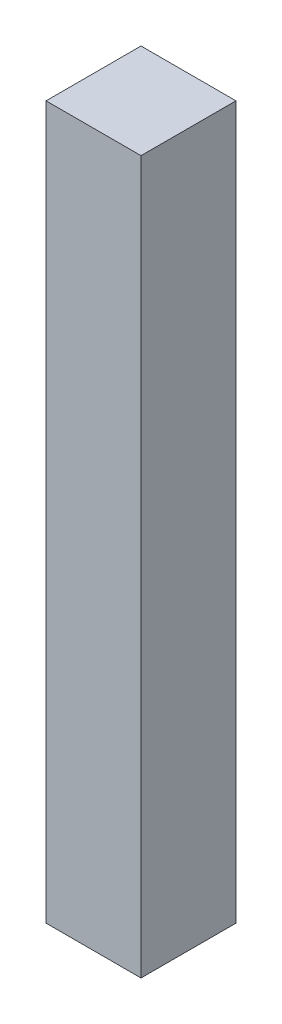
from build123d import *

# Parameters (mm, degrees)
SKETCH1_W           = 5.08
SKETCH1_H           = 38.1
BOSS_EXTRUDE1_DEPTH = 5.08


with BuildPart() as part:
    # Sketch1 → Boss-Extrude1 (new body)
    with BuildSketch(Plane.XY):
        with Locations((2.54, 19.05)):
            Rectangle(SKETCH1_W, SKETCH1_H)
    extrude(amount=BOSS_EXTRUDE1_DEPTH)


solid = part.part
